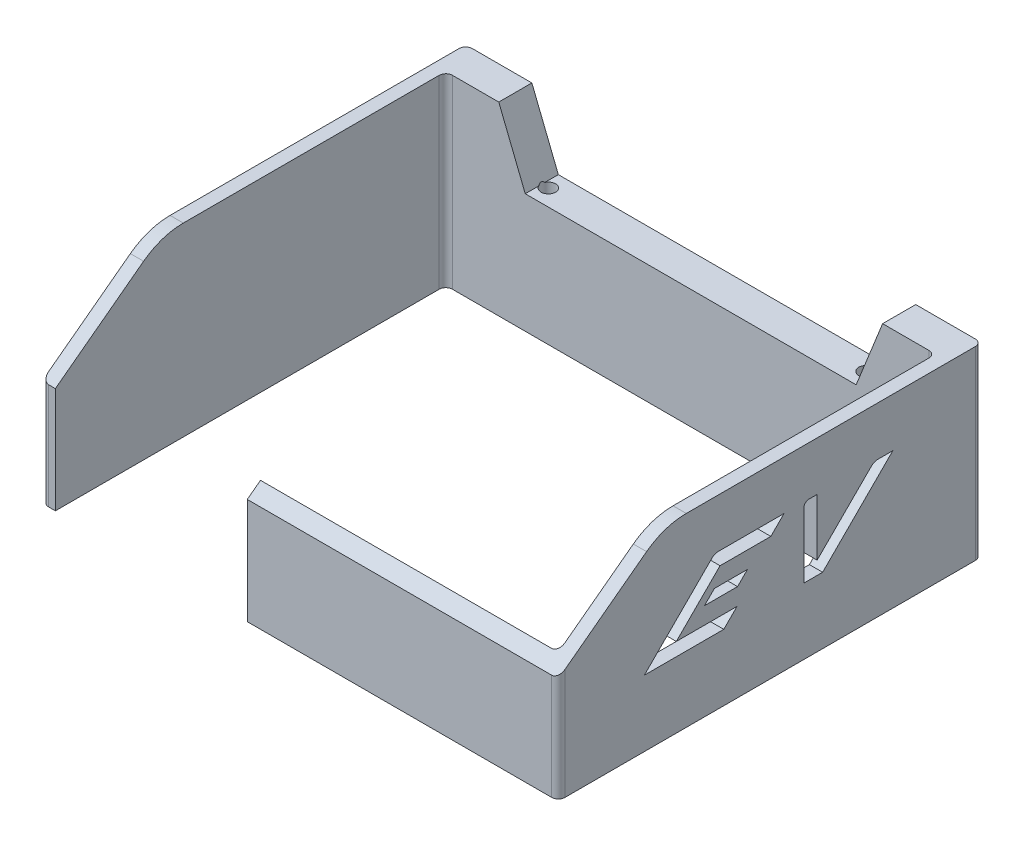
from build123d import *

# Parameters (mm, degrees)
SKETCH_1_R          = 1.1
SKETCH_1_W          = 74
SKETCH_1_H          = 57
EXTRUDE_1_DEPTH     = 28
SKETCH_2_W          = 40
SKETCH_2_H          = 14
CUT_EXTRUDE_1_DEPTH = 28
CUT_EXTRUDE_2_DEPTH = 90.388198326
CUT_EXTRUDE_5_DEPTH = 59.542719445
EXTRUDE_2_DEPTH     = 28
FILLET_1_R          = 1
FILLET_2_R          = 1
FILLET_3_R          = 10
CUT_EXTRUDE_6_REACH = 82.006
CUT_EXTRUDE_7_REACH = 91.388


with BuildPart() as part:
    # 草图1 → 凸台-拉伸1 (new body)
    with BuildSketch(Plane(origin=(0, 0, 0), x_dir=(1, 0, 0), z_dir=(0, 1, 0))):
        Polygon((-39, -30.5), (39, -30.5), (39, 30.5), (39, 33.5), (-39, 33.5), (-39, 30.5), align=None)
        with Locations(Location((24, 31, 0), (0, 0, 270))):
            Circle(SKETCH_1_R, mode=Mode.SUBTRACT)
        with Locations(Location((-24, 31, 0), (0, 0, 270))):
            Circle(SKETCH_1_R, mode=Mode.SUBTRACT)
        Rectangle(SKETCH_1_W, SKETCH_1_H, mode=Mode.SUBTRACT)
    extrude(amount=EXTRUDE_1_DEPTH)

    # 草图2 → 切除-拉伸1 (cut)
    with BuildSketch(Plane(origin=(0, 28, 0), x_dir=(1, 0, 0), z_dir=(0, 1, 0))):
        with Locations((0, -30.5)):
            Rectangle(SKETCH_2_W, SKETCH_2_H)
    extrude(amount=-CUT_EXTRUDE_1_DEPTH, mode=Mode.SUBTRACT)

    # 草图3 → 切除-拉伸2 (cut, through all)
    with BuildSketch(Plane(origin=(39, 0, 0), x_dir=(0, 0, -1), z_dir=(1, 0, 0))):
        Polygon((-30.5, 28), (-14.5, 28), (-30.5, 16), align=None)
    extrude(amount=-CUT_EXTRUDE_2_DEPTH, mode=Mode.SUBTRACT)

    # 草图4 → 切除-拉伸5 (cut, through all)
    with BuildSketch(Plane(origin=(0, 28, 0), x_dir=(1, 0, 0), z_dir=(0, 1, 0))):
        Polygon((-37, -14.5), (-37, -36.587874711), (-17, -36.587874711), (-17, -15.951475091), align=None)
    extrude(amount=-CUT_EXTRUDE_5_DEPTH, mode=Mode.SUBTRACT)

    # 草图5 → 凸台-拉伸2 (add)
    with BuildSketch(Plane.ZY.offset(-20)):
        Polygon((30.5, 0), (30.5, 16), (28.5, 17.5), (28.5, 0), align=None)
    extrude(amount=EXTRUDE_2_DEPTH)

    # 圆角1
    fillet_1_edges = [part.edges().sort_by_distance(p)[0] for p in [
        (-39, 14, -33.5),
        (39, 14, -33.5),
        (39, 8, 30.5),
        (-39, 8, 30.5),
    ]]
    fillet(fillet_1_edges, radius=FILLET_1_R)

    # 圆角2
    fillet_2_edges = [part.edges().sort_by_distance(p)[0] for p in [
        (37, 14, -28.5),
        (-37, 14, -28.5),
        (37, 8.75, 28.5),
    ]]
    fillet(fillet_2_edges, radius=FILLET_2_R)

    # 圆角3
    fillet_3_edges = [part.edges().sort_by_distance(p)[0] for p in [
        (-38, 28, 14.5),
        (38, 28, 14.5),
    ]]
    fillet(fillet_3_edges, radius=FILLET_3_R)

    # 草图8 → 切除-拉伸6 (cut, up to next)
    with BuildSketch(Plane(origin=(0, 0, -33.5), x_dir=(-1, 0, 0), z_dir=(0, 0, -1)), mode=Mode.PRIVATE) as cut_extrude_6_sk1:
        Polygon((29, 28), (-29, 28), (-25, 18), (25, 18), align=None)
    cut_extrude_6_tool1 = extrude(cut_extrude_6_sk1.sketch, amount=-CUT_EXTRUDE_6_REACH, mode=Mode.PRIVATE) & part.part
    add(cut_extrude_6_tool1.solids().sort_by_distance((0, 23.123457, -33.5))[0], mode=Mode.SUBTRACT)

    # 草图9 → 切除-拉伸7 (cut, up to next)
    with BuildSketch(Plane(origin=(39, 0, 0), x_dir=(0, 0, -1), z_dir=(1, 0, 0)), mode=Mode.PRIVATE) as cut_extrude_7_sk1:
        with BuildLine():
            Line((-7.308033396, 20.191966604), (-17.5, 10))
            Line((-17.5, 10), (-5.5, 10))
            Line((-5.5, 10), (-3.5, 12))
            Line((-3.5, 12), (-12.671572875, 12))
            Line((-12.671572875, 12), (-6.064971157, 18.606601718))
            Line((-6.064971157, 18.606601718), (1.606601718, 18.606601718))
            Line((1.606601718, 18.606601718), (3.606601718, 20.606601718))
            Line((3.606601718, 20.606601718), (-6.307015681, 20.606601718))
            ThreePointArc((-6.307015681, 20.606601718), (-6.848762564, 20.498841563), (-7.308033396, 20.191966604))
        make_face()
    cut_extrude_7_tool1 = extrude(cut_extrude_7_sk1.sketch, amount=-CUT_EXTRUDE_7_REACH, mode=Mode.PRIVATE) & part.part
    # 草图9 → 切除-拉伸7 (cut, up to next)
    with BuildSketch(Plane(origin=(39, 0, 0), x_dir=(0, 0, -1), z_dir=(1, 0, 0)), mode=Mode.PRIVATE) as cut_extrude_7_sk2:
        with BuildLine():
            Line((6.606601718, 19.851812513), (6.606601718, 10))
            Line((6.606601718, 10), (9.435028843, 10))
            Line((9.435028843, 10), (20.04163056, 20.606601718))
            Line((20.04163056, 20.606601718), (17.799586037, 20.606601718))
            ThreePointArc((17.799586037, 20.606601718), (17.257839153, 20.498841563), (16.798568322, 20.191966604))
            Line((16.798568322, 20.191966604), (8.606601718, 12))
            Line((8.606601718, 12), (8.606601718, 20.606601718))
            Line((8.606601718, 20.606601718), (7.361390923, 20.606601718))
            ThreePointArc((7.361390923, 20.606601718), (6.827674357, 20.385529078), (6.606601718, 19.851812513))
        make_face()
    cut_extrude_7_tool2 = extrude(cut_extrude_7_sk2.sketch, amount=-CUT_EXTRUDE_7_REACH, mode=Mode.PRIVATE) & part.part
    # 草图9 → 切除-拉伸7 (cut, up to next)
    with BuildSketch(Plane(origin=(39, 0, 0), x_dir=(0, 0, -1), z_dir=(1, 0, 0)), mode=Mode.PRIVATE) as cut_extrude_7_sk3:
        Polygon((-6.921215742, 16.053300859), (-8.421215742, 14.553300859), (-3.421215742, 14.553300859), (-1.921215742, 16.053300859), align=None)
    cut_extrude_7_tool3 = extrude(cut_extrude_7_sk3.sketch, amount=-CUT_EXTRUDE_7_REACH, mode=Mode.PRIVATE) & part.part
    add(cut_extrude_7_tool1.solids().sort_by_distance((39, 14.928952, 12.236985))[0], mode=Mode.SUBTRACT)
    add(cut_extrude_7_tool2.solids().sort_by_distance((39, 14.925906, -6.777774))[0], mode=Mode.SUBTRACT)
    add(cut_extrude_7_tool3.solids().sort_by_distance((39, 15.303301, 5.171216))[0], mode=Mode.SUBTRACT)


solid = part.part
